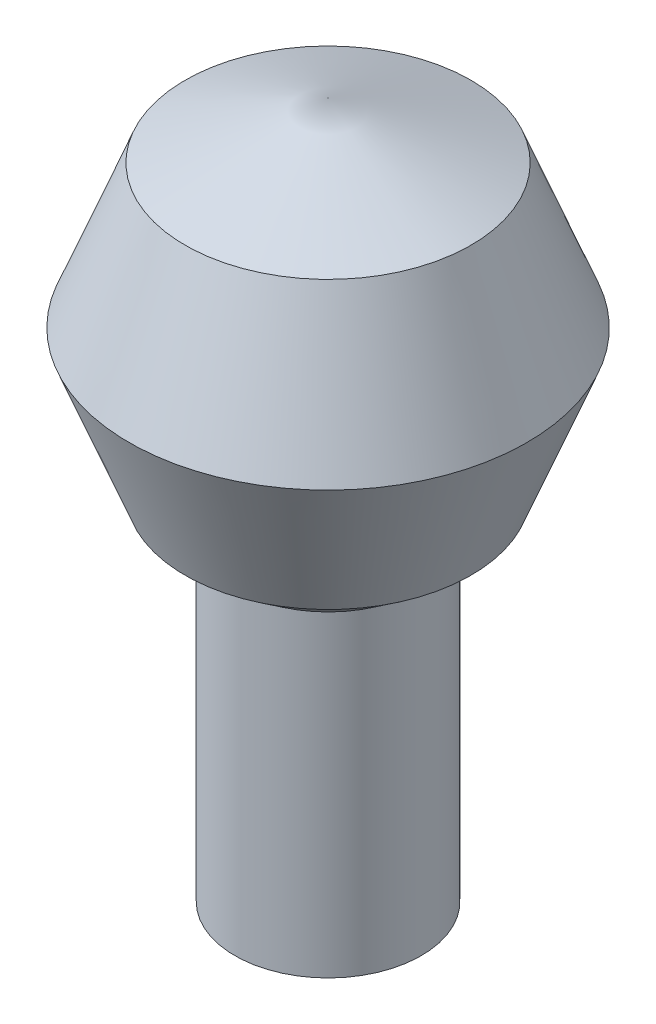
from build123d import *


with BuildPart() as part:
    # Sketch1 → Ancla_de_insercion (revolve)
    with BuildSketch(Plane.XY, mode=Mode.PRIVATE) as ancla_de_insercion_sk:
        Polygon((0, 3.2), (2.3, 2.3), (3.2, 0), (2.3, -2.3), (1.5, -2.9), (1.5, -8), (0, -8), align=None)
    revolve(ancla_de_insercion_sk.sketch.rotate(Axis((0, -12, 0), (0, 1, 0)), 90), axis=Axis((0, -12, 0), (0, 1, 0)))


solid = part.part
